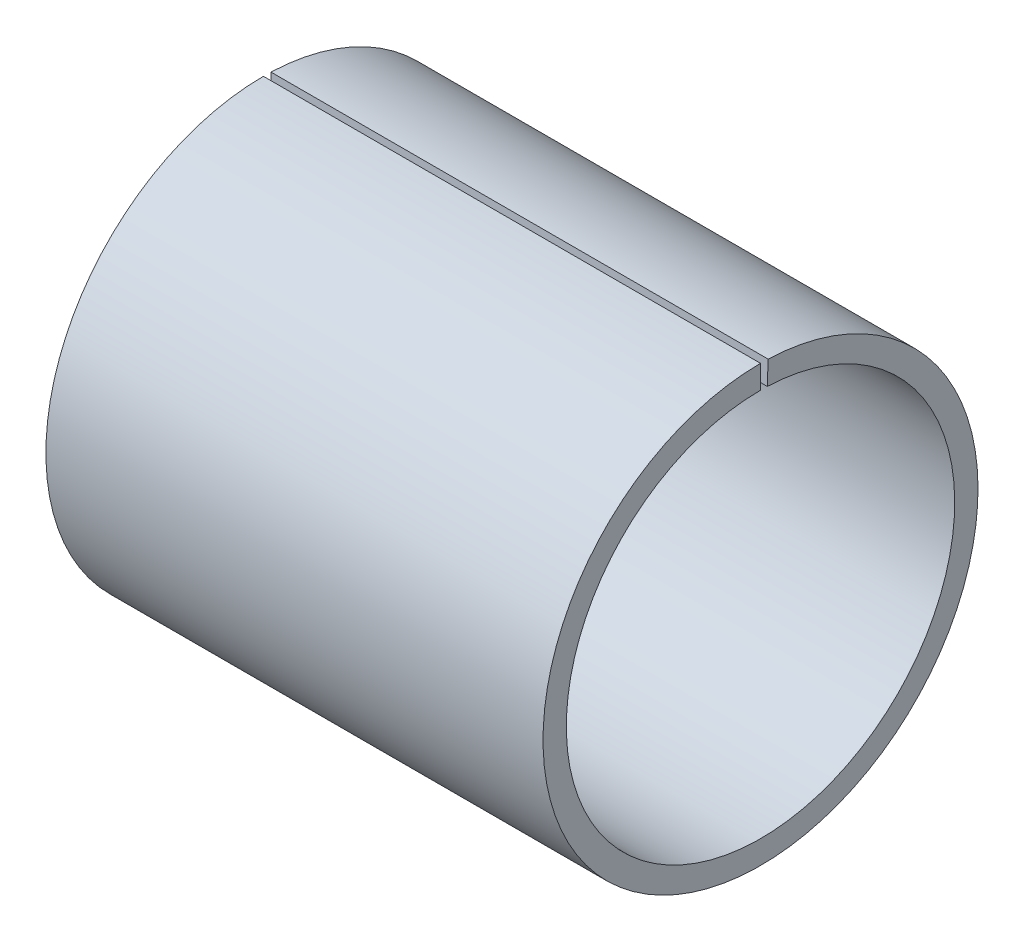
from build123d import *

# Parameters (mm, degrees)
ESQUISSE1_W           = 32
ESQUISSE1_H           = 1.5
BASE_R_VOLUTION_ANGLE = 358


with BuildPart() as part:
    # Esquisse1 → Base-Révolution (revolve)
    with BuildSketch(Plane.XY):
        with Locations((16, 13.25)):
            Rectangle(ESQUISSE1_W, ESQUISSE1_H)
    revolve(axis=Axis((0, 0, 0), (1, 0, 0)), revolution_arc=BASE_R_VOLUTION_ANGLE)


solid = part.part
